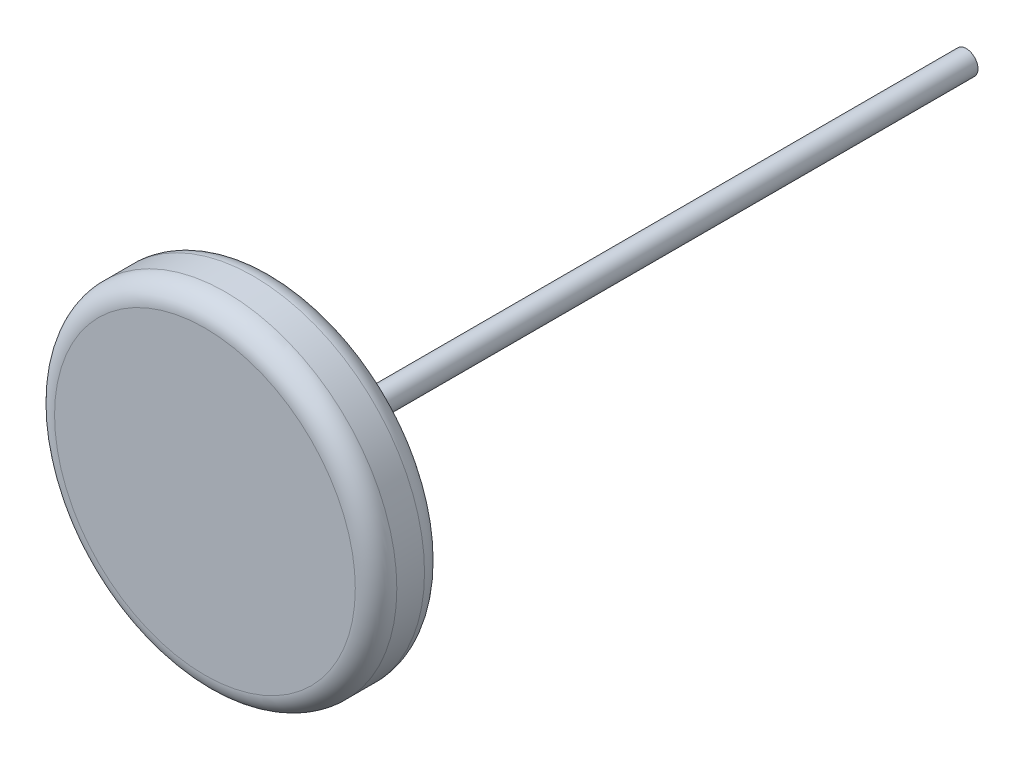
from build123d import *

# Parameters (mm, degrees)
SKETCH1_R           = 1.7
BOSS_EXTRUDE1_DEPTH = 100
SKETCH2_R           = 24.727322232
BOSS_EXTRUDE2_DEPTH = 10
FILLET2_R           = 3


with BuildPart() as part:
    # Sketch1 → Boss-Extrude1 (new body)
    with BuildSketch(Plane.XY):
        Circle(SKETCH1_R)
    extrude(amount=BOSS_EXTRUDE1_DEPTH)

    # Sketch2 → Boss-Extrude2 (add)
    with BuildSketch(Plane.XY.offset(100)):
        Circle(SKETCH2_R)
    extrude(amount=BOSS_EXTRUDE2_DEPTH)

    # Fillet2
    fillet2_edges = [part.edges().sort_by_distance(p)[0] for p in [
        (-1.7, 0, 100),
        (-24.727322232, 0, 100),
        (-24.727322232, 0, 110),
    ]]
    fillet(fillet2_edges, radius=FILLET2_R)


solid = part.part
